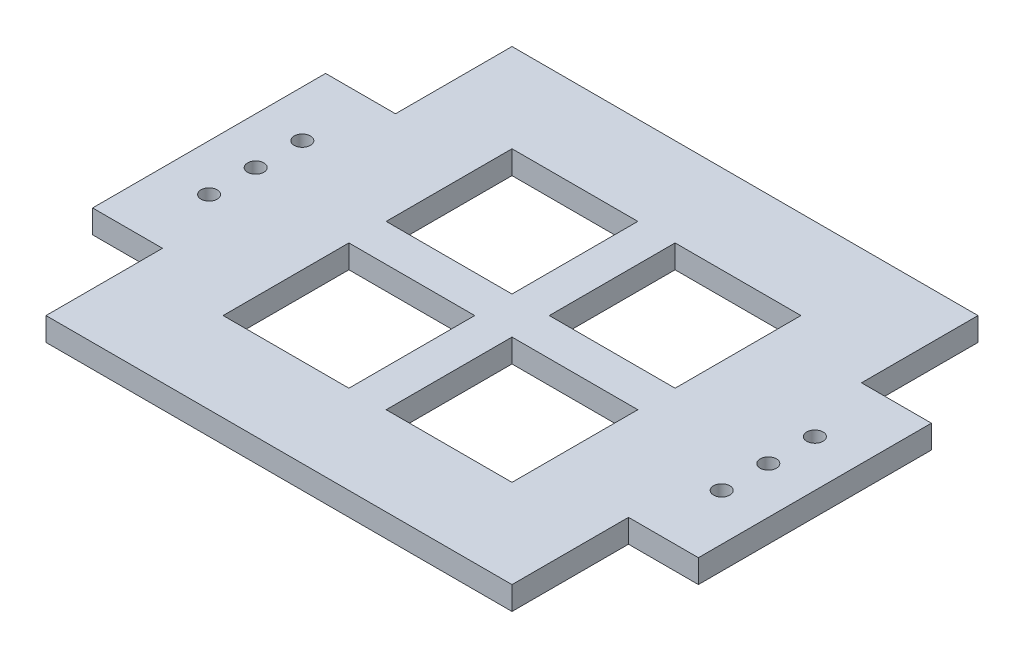
from build123d import *

# Parameters (mm, degrees)
SKETCH1_W           = 200
SKETCH1_H           = 100
BOSS_EXTRUDE1_DEPTH = 5
SKETCH2_R           = 1.75
CUT_EXTRUDE1_DEPTH  = 224.662692463
SKETCH4_R           = 1.75
CUT_EXTRUDE2_DEPTH  = 224.662692463
SKETCH6_W           = 50
SKETCH6_H           = 25
SKETCH6_W_2         = 27
SKETCH6_H_2         = 27
CUT_EXTRUDE4_DEPTH  = 224.662692463
SKETCH7_W           = 35
SKETCH7_H           = 50
SKETCH7_R           = 1.75
CUT_EXTRUDE5_DEPTH  = 224.662692463


with BuildPart() as part:
    # Sketch1 → Boss-Extrude1 (new body)
    with BuildSketch(Plane(origin=(0, 0, 0), x_dir=(1, 0, 0), z_dir=(0, 1, 0))):
        with Locations((100, 50)):
            Rectangle(SKETCH1_W, SKETCH1_H)
    extrude(amount=BOSS_EXTRUDE1_DEPTH)

    # Sketch2 → Cut-Extrude1 (cut, through all)
    with BuildSketch(Plane(origin=(0, 5, 0), x_dir=(1, 0, 0), z_dir=(0, 1, 0))):
        with Locations(Location((170, 60, 0), (0, 0, 270))):
            Circle(SKETCH2_R)
        with Locations(Location((170, 40, 0), (0, 0, 270))):
            Circle(SKETCH2_R)
        with Locations(Location((30, 40, 0), (0, 0, 270))):
            Circle(SKETCH2_R)
        with Locations(Location((30, 60, 0), (0, 0, 90))):
            Circle(SKETCH2_R)
        with Locations(Location((155, 40, 0), (0, 0, 270))):
            Circle(SKETCH2_R)
        with Locations(Location((155, 60, 0), (0, 0, 270))):
            Circle(SKETCH2_R)
        with Locations(Location((45, 60, 0), (0, 0, 270))):
            Circle(SKETCH2_R)
        with Locations(Location((45, 40, 0), (0, 0, 90))):
            Circle(SKETCH2_R)
    extrude(amount=-CUT_EXTRUDE1_DEPTH, mode=Mode.SUBTRACT)

    # Sketch4 → Cut-Extrude2 (cut, through all)
    with BuildSketch(Plane(origin=(0, 5, 0), x_dir=(1, 0, 0), z_dir=(0, 1, 0))):
        with Locations(Location((155, 50, 0), (0, 0, 270))):
            Circle(SKETCH4_R)
        with Locations(Location((45, 50, 0), (0, 0, 270))):
            Circle(SKETCH4_R)
    extrude(amount=-CUT_EXTRUDE2_DEPTH, mode=Mode.SUBTRACT)

    # Sketch6 → Cut-Extrude4 (cut, through all)
    with BuildSketch(Plane(origin=(0, 5, 0), x_dir=(1, 0, 0), z_dir=(0, 1, 0))):
        with Locations((25, 12.5)):
            Rectangle(SKETCH6_W, SKETCH6_H)
        with Locations((25, 87.5)):
            Rectangle(SKETCH6_W, SKETCH6_H)
        with Locations((82.5, 67.5)):
            Rectangle(SKETCH6_W_2, SKETCH6_H_2)
        with Locations((117.5, 67.5)):
            Rectangle(SKETCH6_W_2, SKETCH6_H_2)
        with Locations((82.5, 32.5)):
            Rectangle(SKETCH6_W_2, SKETCH6_H_2)
        with Locations((117.5, 32.5)):
            Rectangle(SKETCH6_W_2, SKETCH6_H_2)
        with Locations((175, 87.5)):
            Rectangle(SKETCH6_W, SKETCH6_H)
        with Locations((175, 12.5)):
            Rectangle(SKETCH6_W, SKETCH6_H)
    extrude(amount=-CUT_EXTRUDE4_DEPTH, mode=Mode.SUBTRACT)

    # Sketch7 → Cut-Extrude5 (cut, through all)
    # profile 1 of 2: a face of its own
    with BuildSketch(Plane(origin=(0, 5, 0), x_dir=(1, 0, 0), z_dir=(0, 1, 0))):
        with Locations((182.5, 50)):
            Rectangle(SKETCH7_W, SKETCH7_H)
        with Locations((170, 40)):
            Circle(SKETCH7_R, mode=Mode.SUBTRACT)
        with Locations((170, 60)):
            Circle(SKETCH7_R, mode=Mode.SUBTRACT)
    # profile 2 of 2: a face of its own
    with BuildSketch(Plane(origin=(0, 5, 0), x_dir=(1, 0, 0), z_dir=(0, 1, 0))):
        with Locations((17.5, 50)):
            Rectangle(SKETCH7_W, SKETCH7_H)
        with Locations((30, 40)):
            Circle(SKETCH7_R, mode=Mode.SUBTRACT)
        with Locations((30, 60)):
            Circle(SKETCH7_R, mode=Mode.SUBTRACT)
    extrude(amount=-CUT_EXTRUDE5_DEPTH, mode=Mode.SUBTRACT)


solid = part.part
